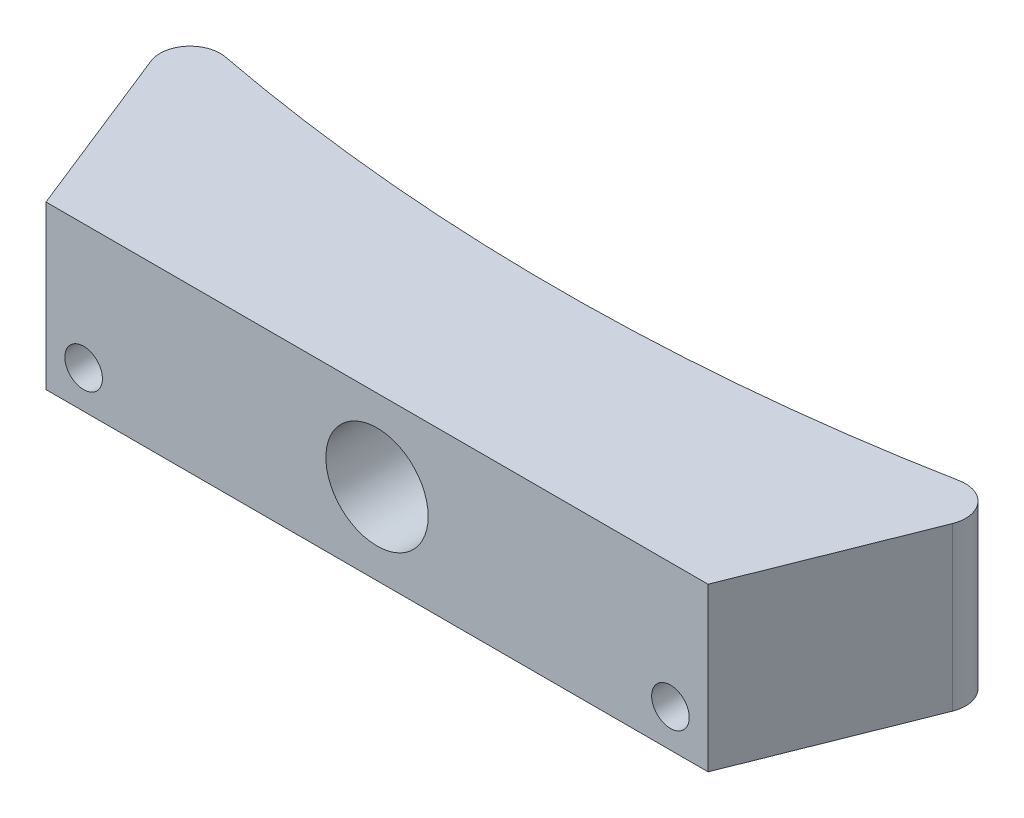
from build123d import *

# Parameters (mm, degrees)
SKETCH_1_R                = 5.4
EXTRUDE_1_DEPTH           = 45
EXTRUDE_3_DEPTH           = 5.4
M8X1_0_TAPPED_HOLE1_D     = 7
M8X1_0_TAPPED_HOLE1_DEPTH = 13
M8X1_0_TAPPED_HOLE1_TIP   = 2.103012167
M3_TAPPED_HOLE1_D         = 2.5
M3_TAPPED_HOLE1_DEPTH     = 7.5
M3_TAPPED_HOLE1_TIP       = 0.751075774
CHAMFER_2_SIZE            = 0.5
SKETCH_9_R                = 4.25
CUT_EXTRUDE_5_DEPTH       = 2
CHAMFER_3_SIZE            = 0.5
SKETCH_10_R               = 6.935438506
CUT_EXTRUDE_1_DEPTH       = 86
HOLE_WIZARD_M8_1_D        = 6.8
HOLE_WIZARD_M8_1_DEPTH    = 9
HOLE_WIZARD_M8_1_TIP      = 2.042926105
FILLET_1_R                = 2


with BuildPart() as part:
    # 草图1 → 拉伸1 (new body)
    with BuildSketch(Plane.XY):
        with Locations(Location((0, 0, 0), (0, 0, 180))):
            Circle(SKETCH_1_R)
    extrude(amount=EXTRUDE_1_DEPTH)

    # 草图4 → 拉伸3 (add, symmetric)
    with BuildSketch(Plane.XZ):
        with BuildLine():
            Line((-22, 0), (22, 0))
            Line((22, 0), (28, -15.05119142))
            ThreePointArc((28, -15.05119142), (0, -12), (-28, -15.05119142))
            Line((-28, -15.05119142), (-22, 0))
        make_face()
    extrude(amount=EXTRUDE_3_DEPTH, both=True)

    # M8x1.0 Tapped Hole1
    with Locations(Plane.XY.offset(45)):
        with Locations((0, 0)):
            Hole(M8X1_0_TAPPED_HOLE1_D / 2, depth=M8X1_0_TAPPED_HOLE1_DEPTH)
            with Locations((0, 0, -(M8X1_0_TAPPED_HOLE1_DEPTH + M8X1_0_TAPPED_HOLE1_TIP / 2))):  # 118° drill point
                Cone(0, M8X1_0_TAPPED_HOLE1_D / 2, M8X1_0_TAPPED_HOLE1_TIP, mode=Mode.SUBTRACT)

    # M3 Tapped Hole1
    with Locations(Plane(origin=(-19.5, -2.9, 0), x_dir=(0, 1, 0), z_dir=(0, 0, 1))):
        with Locations((0, 0), (0, -39)):
            Hole(M3_TAPPED_HOLE1_D / 2, depth=M3_TAPPED_HOLE1_DEPTH)
            with Locations((0, 0, -(M3_TAPPED_HOLE1_DEPTH + M3_TAPPED_HOLE1_TIP / 2))):  # 118° drill point
                Cone(0, M3_TAPPED_HOLE1_D / 2, M3_TAPPED_HOLE1_TIP, mode=Mode.SUBTRACT)

    # 倒角2
    chamfer_2_edges = [part.edges().sort_by_distance(p)[0] for p in [
        (5.4, 0, 45),
    ]]
    chamfer(chamfer_2_edges, length=CHAMFER_2_SIZE)

    # 草图9 → 拉伸5 (cut)
    with BuildSketch(Plane.XY.offset(45)):
        Circle(SKETCH_9_R)
    extrude(amount=-CUT_EXTRUDE_5_DEPTH, mode=Mode.SUBTRACT)

    # 倒角3
    chamfer_3_edges = [part.edges().sort_by_distance(p)[0] for p in [
        (-4.25, 0, 45),
        (3.5, 0, 43),
    ]]
    chamfer(chamfer_3_edges, length=CHAMFER_3_SIZE)

    # 草图10 → 切除-拉伸1 (cut)
    with BuildSketch(Plane.XY):
        Circle(SKETCH_10_R)
    extrude(amount=CUT_EXTRUDE_1_DEPTH, mode=Mode.SUBTRACT)

    # M8 螺纹孔1
    with Locations(Plane.XY):
        with Locations((0, 0)):
            Hole(HOLE_WIZARD_M8_1_D / 2, depth=HOLE_WIZARD_M8_1_DEPTH)
            with Locations((0, 0, -(HOLE_WIZARD_M8_1_DEPTH + HOLE_WIZARD_M8_1_TIP / 2))):  # 118° drill point
                Cone(0, HOLE_WIZARD_M8_1_D / 2, HOLE_WIZARD_M8_1_TIP, mode=Mode.SUBTRACT)

    # 圆角1
    fillet_1_edges = [part.edges().sort_by_distance(p)[0] for p in [
        (-28, 0, -15.05119142),
        (28, 0, -15.05119142),
    ]]
    fillet(fillet_1_edges, radius=FILLET_1_R)


solid = part.part
